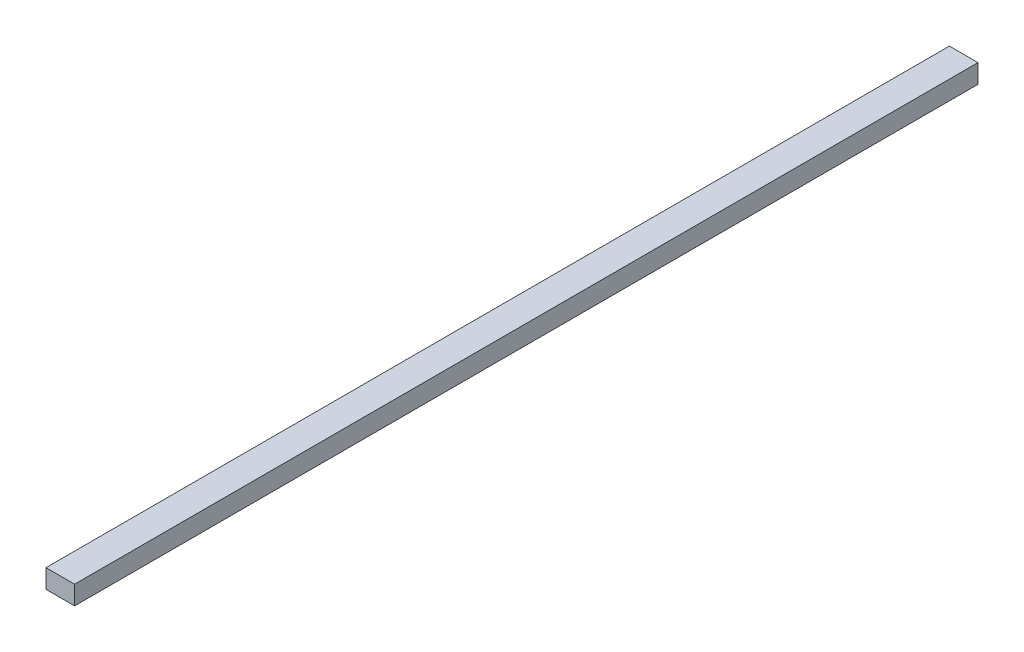
from build123d import *

# Parameters (mm, degrees)
SKETCH1_W           = 9.652
SKETCH1_H           = 6.35
BOSS_EXTRUDE1_DEPTH = 304.8


with BuildPart() as part:
    # Sketch1 → Boss-Extrude1 (new body)
    with BuildSketch(Plane.XY):
        Rectangle(SKETCH1_W, SKETCH1_H)
    extrude(amount=BOSS_EXTRUDE1_DEPTH)


solid = part.part
